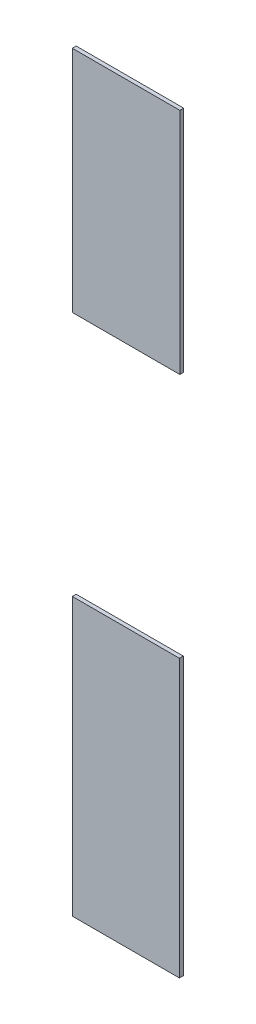
from build123d import *

# Parameters (mm, degrees)
SKETCH_3_W        = 350
SKETCH_3_H        = 744.25
EXTRUDE_1_DEPTH   = 12.5
SKETCH_3_W_2      = 348.5
SKETCH_3_H_2      = 900.75
EXTRUDE_1_2_DEPTH = 12.5


with BuildPart() as part:
    # Эскиз3 → Бобышка-Вытянуть1 (new body)
    with BuildSketch(Plane.XY):
        with Locations((-175, -372.125)):
            Rectangle(SKETCH_3_W, SKETCH_3_H)
    extrude(amount=EXTRUDE_1_DEPTH)


with BuildPart() as body_2:
    # Эскиз3 → Extrude 1 2 (new body)
    with BuildSketch(Plane.XY):
        with Locations((-175.75, -1994.625)):
            Rectangle(SKETCH_3_W_2, SKETCH_3_H_2)
    extrude(amount=EXTRUDE_1_2_DEPTH)


solid = Compound([part.part, body_2.part])
